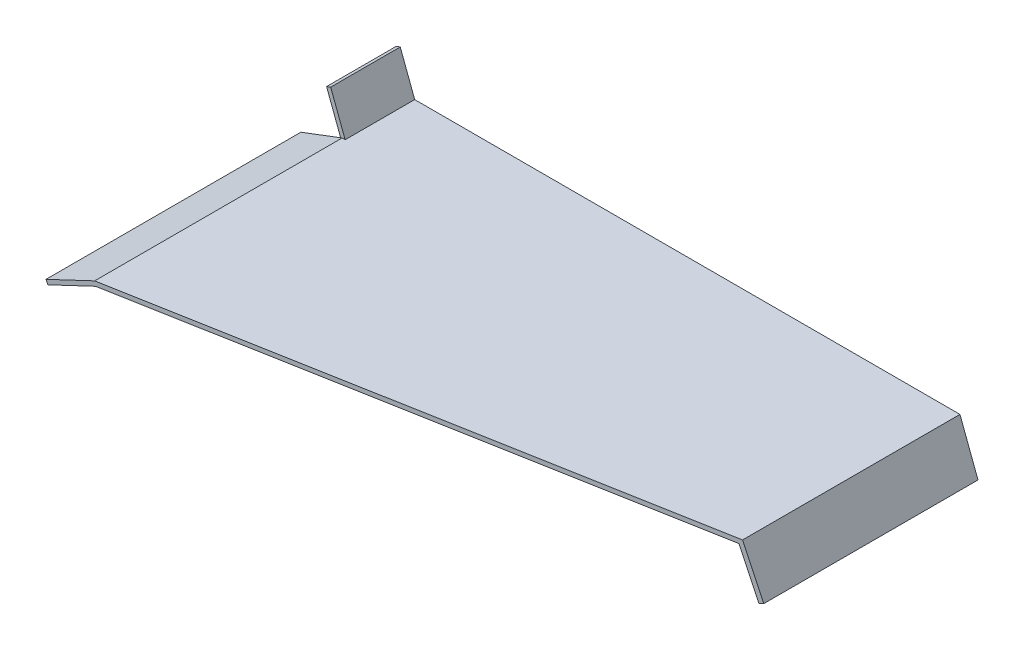
from build123d import *

# Parameters (mm, degrees)
SKETCH1_W           = 395.409928
SKETCH1_H           = 228.6
BOSS_EXTRUDE1_DEPTH = 3.175
CUT_EXTRUDE1_DEPTH  = 3.175
BOSS_EXTRUDE2_REACH = 458.746
BOSS_EXTRUDE3_DEPTH = 50.165
BOSS_EXTRUDE5_REACH = 448.865


with BuildPart() as part:
    # Sketch1 → Boss-Extrude1 (new body)
    with BuildSketch(Plane(origin=(0, 0, 0), x_dir=(1, 0, 0), z_dir=(0, 1, 0))):
        with Locations((197.704964, 114.3)):
            Rectangle(SKETCH1_W, SKETCH1_H)
    extrude(amount=BOSS_EXTRUDE1_DEPTH)

    # Sketch2 → Cut-Extrude1 (cut)
    with BuildSketch(Plane(origin=(0, 3.175, 0), x_dir=(1, 0, 0), z_dir=(0, 1, 0))):
        Polygon((0, 0), (395.409928, 71.795894), (395.409928, 0), align=None)
    extrude(amount=-CUT_EXTRUDE1_DEPTH, mode=Mode.SUBTRACT)

    # Boss-Extrude2: up to this plane
    boss_extrude2_end = Plane(origin=(0, 0, 0), z_dir=(-0.17865222161961358, 0, -0.9839122845611679))
    # Sketch3 → Boss-Extrude2 (add, up to the surface)
    with BuildSketch(Plane(origin=(0, 0, -228.6), x_dir=(-1, 0, 0), z_dir=(0, 0, -1)), mode=Mode.PRIVATE) as boss_extrude2_sk1:
        Polygon((-395.409928, 3.175), (-408.410752554, -31.284069357), (-405.440143126, -32.404830094), (-392.016474486, 3.175), align=None)
    boss_extrude2_tool1 = split(extrude(boss_extrude2_sk1.sketch, amount=-BOSS_EXTRUDE2_REACH, mode=Mode.PRIVATE), bisect_by=boss_extrude2_end, keep=Keep.BOTH, mode=Mode.PRIVATE)
    add(boss_extrude2_tool1.solids().sort_by_distance((400.310838, -14.336219, -228.6))[0])

    # Sketch4 → Boss-Extrude3 (add)
    with BuildSketch(Plane(origin=(0, 0, -228.6), x_dir=(-1, 0, 0), z_dir=(0, 0, -1))):
        Polygon((0, 0), (11.207607374, 29.706094273), (8.236997947, 30.82685501), (-3.393453514, 0), align=None)
    extrude(amount=-BOSS_EXTRUDE3_DEPTH)

    # Boss-Extrude5: up to this plane
    boss_extrude5_end = Plane(origin=(0, 0, 0), z_dir=(-0.17865222161961358, 0, -0.9839122845611679))
    # Sketch6 → Boss-Extrude5 (add, up to the surface)
    with BuildSketch(Plane.XY.offset(-178.435), mode=Mode.PRIVATE) as boss_extrude5_sk1:
        Polygon((0, 3.175), (-29.706094273, -8.032607374), (-28.585333536, -11.003216801), (8.994448738, 3.175), align=None)
    boss_extrude5_tool1 = split(extrude(boss_extrude5_sk1.sketch, amount=BOSS_EXTRUDE5_REACH, mode=Mode.PRIVATE), bisect_by=boss_extrude5_end, keep=Keep.BOTH, mode=Mode.PRIVATE)
    add(boss_extrude5_tool1.solids().sort_by_distance((-12.225606, -3.200424, -178.435))[0])


solid = part.part
